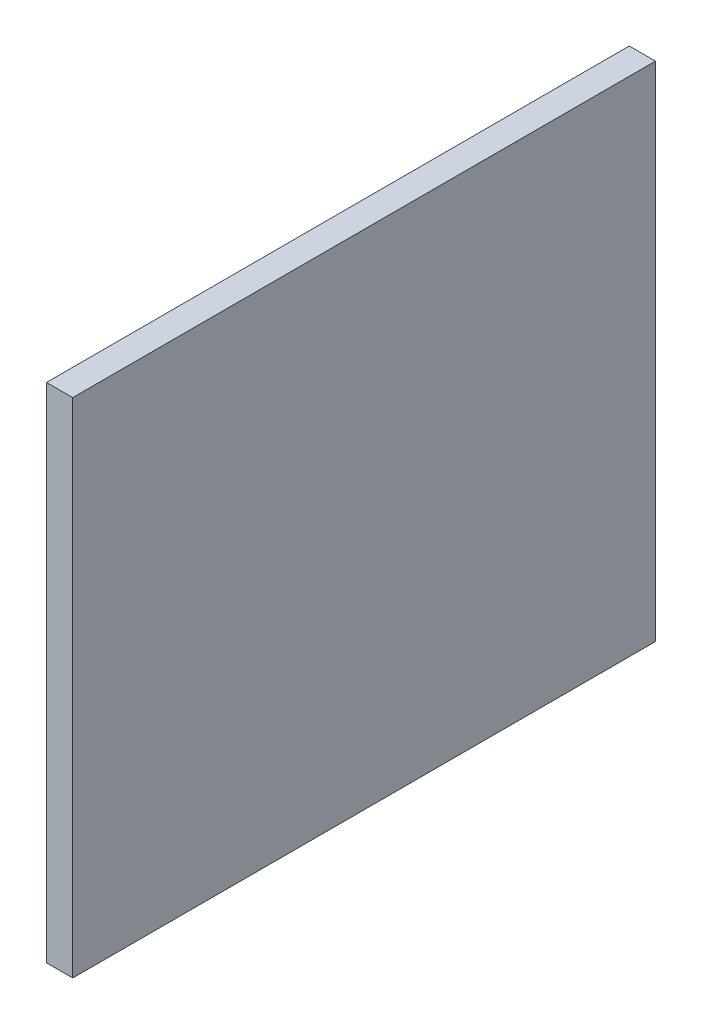
from build123d import *

# Parameters (mm, degrees)
SKETCH1_W           = 400
SKETCH1_H           = 345
BOSS_EXTRUDE1_DEPTH = 18


with BuildPart() as part:
    # Sketch1 → Boss-Extrude1 (new body)
    with BuildSketch(Plane(origin=(0, 0, 0), x_dir=(0, 0, -1), z_dir=(1, 0, 0))):
        Rectangle(SKETCH1_W, SKETCH1_H)
    extrude(amount=BOSS_EXTRUDE1_DEPTH)


solid = part.part
